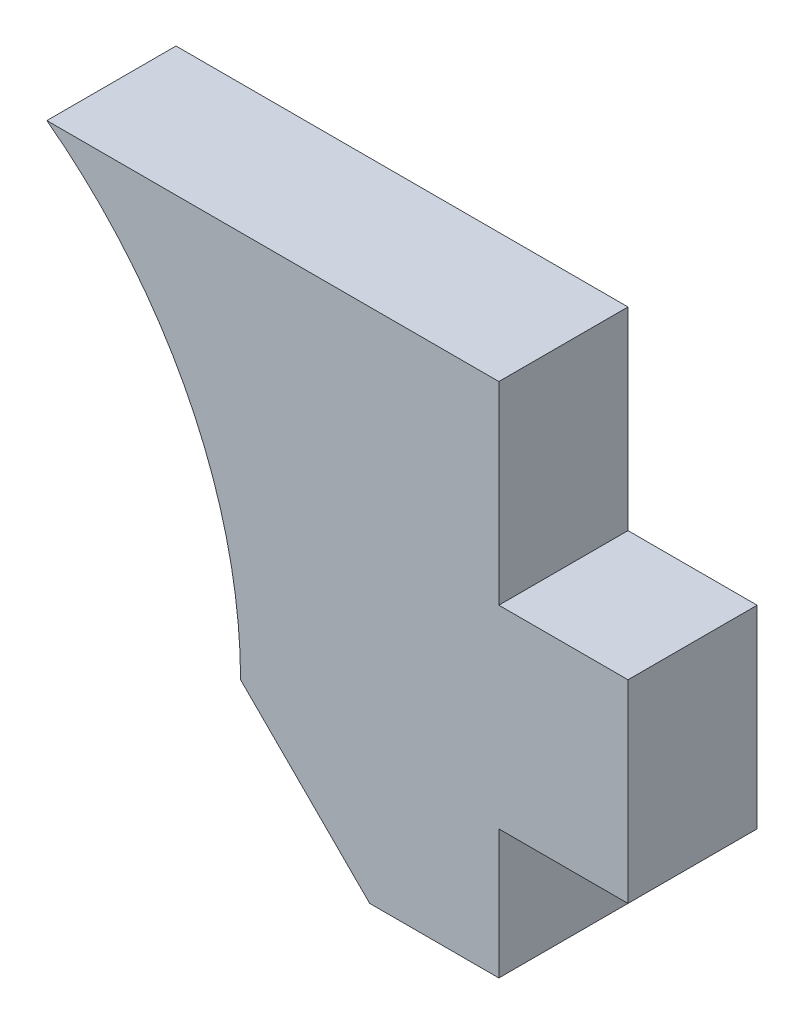
from build123d import *

# Parameters (mm, degrees)
BOSS_EXTRUDE1_DEPTH = 3


with BuildPart() as part:
    # Sketch1 → Boss-Extrude1 (new body)
    with BuildSketch(Plane.XY):
        with BuildLine():
            Line((490.924864814, 8.749554885), (490.924864814, 5.749554885))
            Line((490.924864814, 5.749554885), (487.924864814, 5.749554885))
            Line((487.924864814, 5.749554885), (484.924864814, 8.749554885))
            ThreePointArc((484.924864814, 8.749554885), (483.737170712, 13.780707835), (480.424864814, 17.749554885))
            Line((480.424864814, 17.749554885), (490.924864814, 17.749554885))
            Line((490.924864814, 17.749554885), (490.924864814, 13.249554885))
            Line((490.924864814, 13.249554885), (493.924864814, 13.249554885))
            Line((493.924864814, 13.249554885), (493.924864814, 8.749554885))
            Line((493.924864814, 8.749554885), (490.924864814, 8.749554885))
        make_face()
    extrude(amount=BOSS_EXTRUDE1_DEPTH)


solid = part.part
